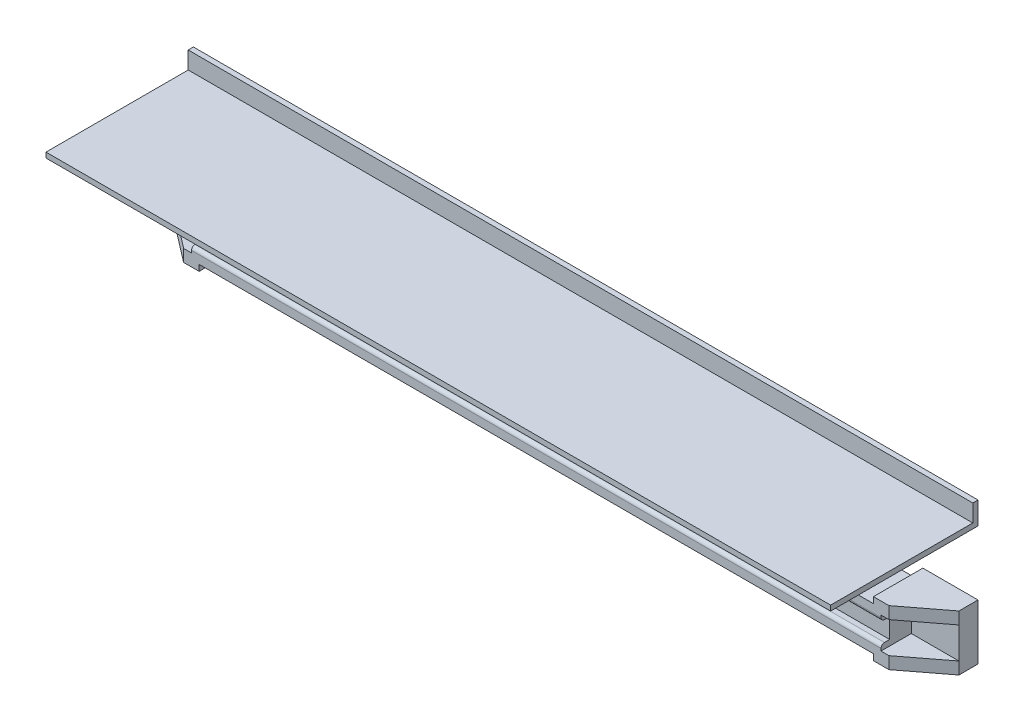
from build123d import *

# Parameters (mm, degrees)
SKETCH1_W               = 400
SKETCH1_H               = 25
BOSS_EXTRUDE1_DEPTH     = 25
SKETCH2_W               = 386.4
SKETCH2_H               = 11.4
CUT_EXTRUDE2_DEPTH      = 5
SKETCH4_W               = 32
SKETCH4_H               = 32
SKETCH4_W_2             = 25
SKETCH4_H_2             = 25
BOSS_EXTRUDE2_DEPTH     = 6.8
SKETCH5_W               = 32
SKETCH5_H               = 32
BOSS_EXTRUDE3_DEPTH     = 25
SKETCH6_W               = 27.448100552
SKETCH6_H               = 18
CUT_EXTRUDE3_DEPTH      = 21
CUT_EXTRUDE4_DEPTH      = 43
CUT_EXTRUDE5_DEPTH      = 43
CUT_EXTRUDE5_DEPTH_BACK = 413
BOSS_EXTRUDE4_DEPTH     = 452.448100552


with BuildPart() as part:
    # Sketch1 → Boss-Extrude1 (new body)
    with BuildSketch(Plane.XY):
        with Locations((200, 12.5)):
            Rectangle(SKETCH1_W, SKETCH1_H)
    extrude(amount=BOSS_EXTRUDE1_DEPTH)

    # Sketch2 → Cut-Extrude2 (cut)
    with BuildSketch(Plane.XY.offset(25)):
        with Locations((200, 12.5)):
            Rectangle(SKETCH2_W, SKETCH2_H)
    extrude(amount=-CUT_EXTRUDE2_DEPTH, mode=Mode.SUBTRACT)



with BuildPart() as body_2:
    # Sketch4 → Boss-Extrude2 (new body)
    with BuildSketch(Plane(origin=(6.8, 0, 0), x_dir=(0, 0, -1), z_dir=(1, 0, 0))):
        with Locations((-12.5, 12.5)):
            Rectangle(SKETCH4_W, SKETCH4_H)
        with Locations((-12.5, 12.5)):
            Rectangle(SKETCH4_W_2, SKETCH4_H_2, mode=Mode.SUBTRACT)
    extrude(amount=-BOSS_EXTRUDE2_DEPTH)


with BuildPart() as part_1:
    add(part.part)

    add(body_2.part)  # Boss-Extrude3 merges body 2
    # Sketch5 → Boss-Extrude3 (add)
    with BuildSketch(Plane.ZY):
        with Locations((12.5, 12.5)):
            Rectangle(SKETCH5_W, SKETCH5_H)
    extrude(amount=BOSS_EXTRUDE3_DEPTH)

    # Sketch6 → Cut-Extrude3 (cut)
    with BuildSketch(Plane.XY.offset(28.5)):
        with Locations((-11.275949724, 12.5)):
            Rectangle(SKETCH6_W, SKETCH6_H)
    extrude(amount=-CUT_EXTRUDE3_DEPTH, mode=Mode.SUBTRACT)

    # Sketch7 → Cut-Extrude4 (cut)
    with BuildSketch(Plane.XZ.offset(3.5)):
        Polygon((2.448100552, 28.5), (-25, 28.5), (-25, 7.5), align=None)
    extrude(amount=-CUT_EXTRUDE4_DEPTH, mode=Mode.SUBTRACT)

    # Sketch8 → Cut-Extrude5 (cut, two sides: drawn at the far end of the back side and taken through both)
    with BuildSketch(Plane.ZY.offset(-2.448100552).offset(-CUT_EXTRUDE5_DEPTH_BACK)):
        with BuildLine():
            Line((20, 6.8), (23, 6.8))
            ThreePointArc((23, 6.8), (24.414213562, 6.214213562), (25, 4.8))
            Line((25, 4.8), (25, -5.020840196))
            Line((25, -5.020840196), (31.991589763, -5.020840196))
            Line((31.991589763, -5.020840196), (31.991589763, 30.746420452))
            Line((31.991589763, 30.746420452), (25, 30.746420452))
            Line((25, 30.746420452), (25, 20.2))
            ThreePointArc((25, 20.2), (24.414213562, 18.785786438), (23, 18.2))
            Line((23, 18.2), (20, 18.2))
            Line((20, 18.2), (20, 6.8))
        make_face()
    extrude(amount=CUT_EXTRUDE5_DEPTH + CUT_EXTRUDE5_DEPTH_BACK, mode=Mode.SUBTRACT)

    # Mirror6: part across plane


with BuildPart() as part_2:
    add(part_1.part)
    add(part_1.part.mirror(Plane(origin=(201.224050276, 0, 0), x_dir=(0, 0, 1), z_dir=(1, 0, 0))))


with BuildPart() as body_2_2:
    # Sketch9 → Boss-Extrude4 (new body)
    with BuildSketch(Plane(origin=(427.448100552, 0, 0), x_dir=(0, 0, -1), z_dir=(1, 0, 0))):
        Polygon((3.5, 78.438077684), (3.5, 65.438077684), (-81.5, 65.438077684), (-81.5, 68.438077684), (0.5, 68.438077684), (0.5, 78.438077684), align=None)
    extrude(amount=-BOSS_EXTRUDE4_DEPTH)


solid = Compound([part_2.part, body_2_2.part])
